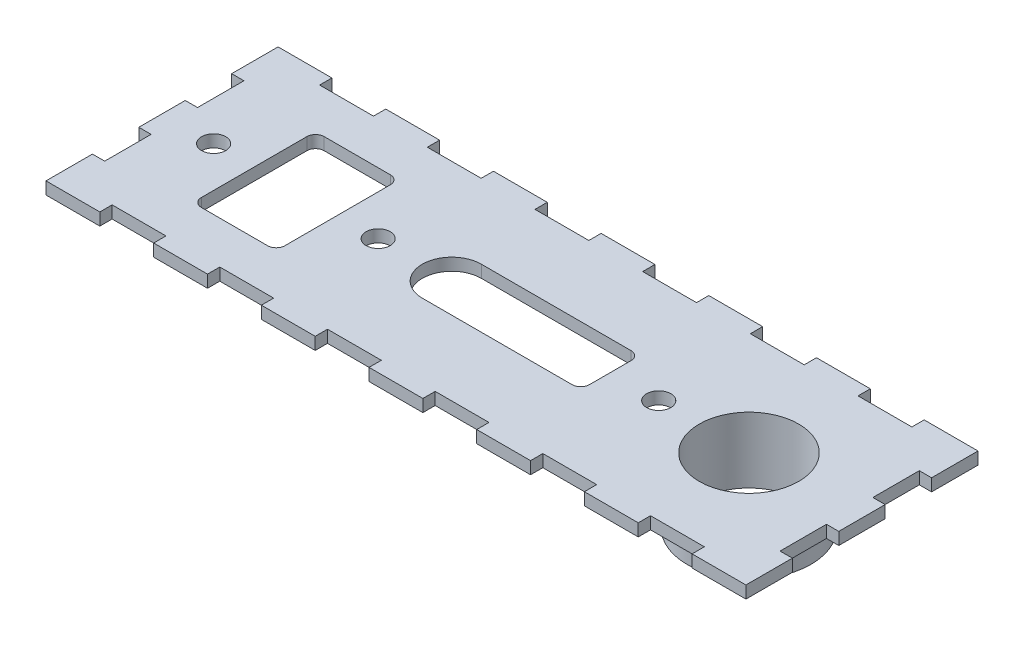
from build123d import *
from build123d.topology import SkipClean

# Parameters (mm, degrees)
SKETCH1_W           = 144.78
SKETCH1_H           = 48.006
SKETCH1_R           = 10.287
SKETCH1_W_2         = 17.272
SKETCH1_H_2         = 25.4
BOSS_EXTRUDE1_DEPTH = 2.54
FILLET1_R           = 1.778
SKETCH2_OUTSIDE_W   = 177.29
SKETCH2_OUTSIDE_H   = 80.516
CUT_EXTRUDE1_DEPTH  = 2.54
SKETCH3_R           = 2.5
CUT_EXTRUDE2_DEPTH  = 80.084400042
BOSS_EXTRUDE2_START = 11.049
SKETCH4_R           = 12.827
SKETCH4_R_2         = 10.287
BOSS_EXTRUDE2_DEPTH = 11.049


with BuildPart() as part:
    # Sketch1 → Boss-Extrude1 (new body)
    with BuildSketch(Plane(origin=(0, 0, 0), x_dir=(1, 0, 0), z_dir=(0, 1, 0))):
        with Locations((2.921, 0)):
            Rectangle(SKETCH1_W, SKETCH1_H)
        with Locations(Location((51.943, 0, 0), (0, 0, 270))):
            Circle(SKETCH1_R, mode=Mode.SUBTRACT)
        with Locations((-41.783, 0)):
            Rectangle(SKETCH1_W_2, SKETCH1_H_2, mode=Mode.SUBTRACT)
        with BuildLine():
            Line((23.241, -6.096), (-9.525, -6.096))
            ThreePointArc((-9.525, -6.096), (-15.621, 0), (-9.525, 6.096))
            Line((-9.525, 6.096), (23.241, 6.096))
            Line((23.241, 6.096), (23.241, -6.096))
        make_face(mode=Mode.SUBTRACT)
    extrude(amount=BOSS_EXTRUDE1_DEPTH)

    # Fillet1
    fillet1_edges = [part.edges().sort_by_distance(p)[0] for p in [
        (23.241, 1.27, 6.096),
        (23.241, 1.27, -6.096),
        (-50.419, 1.27, -12.7),
        (-50.419, 1.27, 12.7),
        (-33.147, 1.27, 12.7),
        (-33.147, 1.27, -12.7),
    ]]
    fillet(fillet1_edges, radius=FILLET1_R)

    # Sketch2 outside → Cut-Extrude1 (cut)
    with BuildSketch(Plane(origin=(0, 2.54, 0), x_dir=(1, 0, 0), z_dir=(0, 1, 0))):
        with Locations((2.921, 0)):
            Rectangle(SKETCH2_OUTSIDE_W, SKETCH2_OUTSIDE_H)
        Polygon((-69.469, 24.003), (-69.469, 14.4018), (-66.929, 14.4018), (-66.929, 4.8006), (-69.469, 4.8006), (-69.469, -4.8006), (-66.929, -4.8006), (-66.929, -14.4018), (-69.469, -14.4018), (-69.469, -24.003), (-58.332076923, -24.003), (-58.332076923, -21.463), (-47.195153846, -21.463), (-47.195153846, -24.003), (-36.058230769, -24.003), (-36.058230769, -21.463), (-24.921307692, -21.463), (-24.921307692, -24.003), (-13.784384615, -24.003), (-13.784384615, -21.463), (-2.647461538, -21.463), (-2.647461538, -24.003), (8.489461538, -24.003), (8.489461538, -21.463), (19.626384615, -21.463), (19.626384615, -24.003), (30.763307692, -24.003), (30.763307692, -21.463), (41.900230769, -21.463), (41.900230769, -24.003), (53.037153846, -24.003), (53.037153846, -21.463), (64.174076923, -21.463), (64.174076923, -24.003), (75.311, -24.003), (75.311, -14.4018), (72.771, -14.4018), (72.771, -4.8006), (75.311, -4.8006), (75.311, 4.8006), (72.771, 4.8006), (72.771, 14.4018), (75.311, 14.4018), (75.311, 24.003), (64.174076923, 24.003), (64.174076923, 21.463), (53.037153846, 21.463), (53.037153846, 24.003), (41.900230769, 24.003), (41.900230769, 21.463), (30.763307692, 21.463), (30.763307692, 24.003), (19.626384615, 24.003), (19.626384615, 21.463), (8.489461538, 21.463), (8.489461538, 24.003), (-2.647461538, 24.003), (-2.647461538, 21.463), (-13.784384615, 21.463), (-13.784384615, 24.003), (-24.921307692, 24.003), (-24.921307692, 21.463), (-36.058230769, 21.463), (-36.058230769, 24.003), (-47.195153846, 24.003), (-47.195153846, 21.463), (-58.332076923, 21.463), (-58.332076923, 24.003), align=None, mode=Mode.SUBTRACT)
    extrude(amount=-CUT_EXTRUDE1_DEPTH, mode=Mode.SUBTRACT)

    # Sketch3 → Cut-Extrude2 (cut, through all)
    with BuildSketch(Plane(origin=(0, 2.54, 0), x_dir=(1, 0, 0), z_dir=(0, 1, 0))):
        with Locations(Location((-58.801, 0, 0), (0, 0, 270))):
            Circle(SKETCH3_R)
        with Locations(Location((-24.765, 0, 0), (0, 0, 270))):
            Circle(SKETCH3_R)
        with Locations(Location((33.274, 0, 0), (0, 0, 270))):
            Circle(SKETCH3_R)
    extrude(amount=-CUT_EXTRUDE2_DEPTH, mode=Mode.SUBTRACT)

    # Sketch4 → Boss-Extrude2 (add)
    with SkipClean():  # the faces are left unmerged after this step: merging them gives an invalid solid
        with BuildSketch(Plane.XZ.offset(BOSS_EXTRUDE2_START)):
            with Locations(Location((51.943, 0, 0), (0, 0, 90))):
                Circle(SKETCH4_R)
            with Locations(Location((51.943, 0, 0), (0, 0, 270))):
                Circle(SKETCH4_R_2, mode=Mode.SUBTRACT)
        extrude(amount=-BOSS_EXTRUDE2_DEPTH)


solid = part.part
